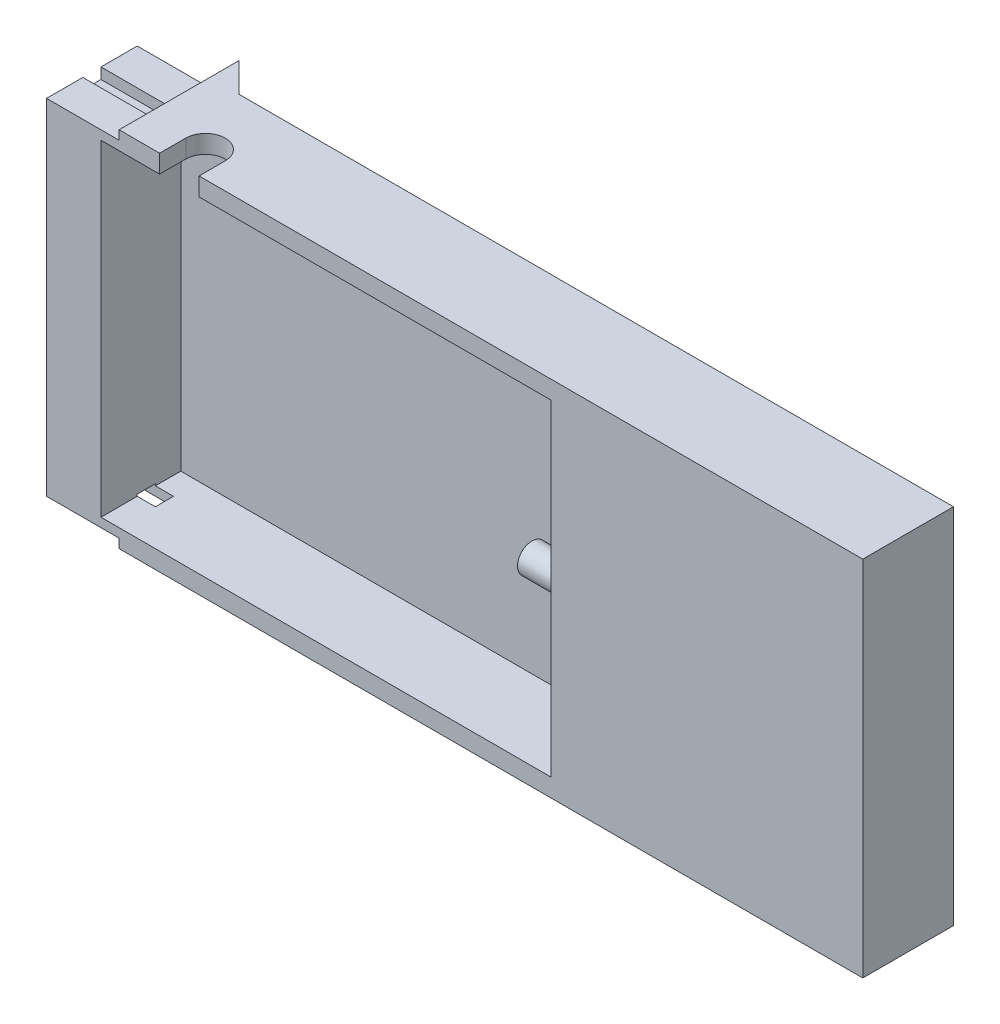
from build123d import *

# Parameters (mm, degrees)
SKETCH1_W           = 170
SKETCH1_H           = 100
BOSS_EXTRUDE1_DEPTH = 15
SKETCH3_W           = 70
SKETCH3_H           = 90
CUT_EXTRUDE2_DEPTH  = 12
SKETCH8_W           = 15
SKETCH8_H           = 15
CUT_EXTRUDE9_DEPTH  = 2.5
SKETCH9_W           = 15
SKETCH9_H           = 15
CUT_EXTRUDE10_DEPTH = 2.5
SKETCH10_W          = 12
SKETCH10_H          = 90
CUT_EXTRUDE11_DEPTH = 58
SKETCH11_W          = 128
SKETCH11_H          = 90
BOSS_EXTRUDE2_DEPTH = 10
SKETCH12_W          = 22
SKETCH12_H          = 90
BOSS_EXTRUDE4_DEPTH = 4
BOSS_EXTRUDE6_DEPTH = 100
SKETCH15_W          = 5
SKETCH15_H          = 3
CUT_EXTRUDE14_DEPTH = 15
SKETCH16_W          = 25
SKETCH16_H          = 100
BOSS_EXTRUDE7_DEPTH = 50
SKETCH17_W          = 70
SKETCH17_H          = 70
CUT_EXTRUDE15_DEPTH = 22
SKETCH18_W          = 74
SKETCH18_H          = 74
SKETCH18_W_2        = 70
SKETCH18_H_2        = 70
CUT_EXTRUDE16_DEPTH = 4
BOSS_EXTRUDE8_DEPTH = 5
SKETCH20_R          = 4
SKETCH20_R_2        = 3
BOSS_EXTRUDE9_DEPTH = 23
SKETCH20_2_R        = 3
CUT_EXTRUDE17_DEPTH = 23
CUT_EXTRUDE18_DEPTH = 23


with BuildPart() as part:
    # Sketch1 → Boss-Extrude1 (new body)
    with BuildSketch(Plane.XY):
        with Locations((-16.108033241, 2.077562327)):
            Rectangle(SKETCH1_W, SKETCH1_H)
    extrude(amount=BOSS_EXTRUDE1_DEPTH)

    # Sketch3 → Cut-Extrude2 (cut)
    with BuildSketch(Plane.XY.offset(15)):
        with Locations((-56.108033241, 2.077562327)):
            Rectangle(SKETCH3_W, SKETCH3_H)
    extrude(amount=-CUT_EXTRUDE2_DEPTH, mode=Mode.SUBTRACT)

    # Sketch8 → Cut-Extrude9 (cut)
    with BuildSketch(Plane(origin=(0, 52.077562327, 0), x_dir=(1, 0, 0), z_dir=(0, 1, 0))):
        with Locations((-93.608033241, -7.5)):
            Rectangle(SKETCH8_W, SKETCH8_H)
    extrude(amount=-CUT_EXTRUDE9_DEPTH, mode=Mode.SUBTRACT)

    # Sketch9 → Cut-Extrude10 (cut)
    with BuildSketch(Plane.XZ.offset(47.922437673)):
        with Locations((-93.608033241, 7.5)):
            Rectangle(SKETCH9_W, SKETCH9_H)
    extrude(amount=-CUT_EXTRUDE10_DEPTH, mode=Mode.SUBTRACT)

    # Sketch10 → Cut-Extrude11 (cut)
    with BuildSketch(Plane.ZY.offset(21.108033241)):
        with Locations((9, 2.077562327)):
            Rectangle(SKETCH10_W, SKETCH10_H)
    extrude(amount=-CUT_EXTRUDE11_DEPTH, mode=Mode.SUBTRACT)

    # Sketch11 → Boss-Extrude2 (add)
    with BuildSketch(Plane.XY.offset(15)):
        Polygon((-86.108033241, -45.422437673), (-86.108033241, -47.922437673), (68.891966759, -47.922437673), (68.891966759, 52.077562327), (-86.108033241, 52.077562327), (-86.108033241, 49.577562327), (-101.108033241, 49.577562327), (-101.108033241, -45.422437673), align=None)
        with Locations((-27.108033241, 2.077562327)):
            Rectangle(SKETCH11_W, SKETCH11_H, mode=Mode.SUBTRACT)
    extrude(amount=BOSS_EXTRUDE2_DEPTH)

    # Sketch12 → Boss-Extrude4 (add)
    with BuildSketch(Plane.ZY.offset(-36.891966759)):
        with Locations((14, 2.077562327)):
            Rectangle(SKETCH12_W, SKETCH12_H)
    extrude(amount=BOSS_EXTRUDE4_DEPTH)

    # Sketch14 → Boss-Extrude6 (add)
    with BuildSketch(Plane(origin=(0, 52.077562327, 0), x_dir=(1, 0, 0), z_dir=(0, 1, 0))):
        Polygon((-86.108033241, 0), (-78.108033241, 0), (-86.108033241, 8), align=None)
    extrude(amount=-BOSS_EXTRUDE6_DEPTH)

    # Sketch15 → Cut-Extrude14 (cut)
    with BuildSketch(Plane.ZY.offset(101.108033241)):
        with Locations((12.5, -43.922437673)):
            Rectangle(SKETCH15_W, SKETCH15_H)
        with Locations((12.5, 48.077562327)):
            Rectangle(SKETCH15_W, SKETCH15_H)
    extrude(amount=-CUT_EXTRUDE14_DEPTH, mode=Mode.SUBTRACT)

    # Sketch16 → Boss-Extrude7 (add)
    with BuildSketch(Plane(origin=(68.891966759, 0, 0), x_dir=(0, 0, -1), z_dir=(1, 0, 0))):
        with Locations((-12.5, 2.077562327)):
            Rectangle(SKETCH16_W, SKETCH16_H)
    extrude(amount=BOSS_EXTRUDE7_DEPTH)

    # Sketch17 → Cut-Extrude15 (cut)
    with BuildSketch(Plane(origin=(0, 0, 0), x_dir=(-1, 0, 0), z_dir=(0, 0, -1))):
        with Locations((-78.891966759, 2.077562327)):
            Rectangle(SKETCH17_W, SKETCH17_H)
    extrude(amount=-CUT_EXTRUDE15_DEPTH, mode=Mode.SUBTRACT)

    # Sketch18 → Cut-Extrude16 (cut)
    with BuildSketch(Plane(origin=(0, 0, 0), x_dir=(-1, 0, 0), z_dir=(0, 0, -1))):
        with Locations((-78.891966759, 2.077562327)):
            Rectangle(SKETCH18_W, SKETCH18_H)
        with Locations((-78.891966759, 2.077562327)):
            Rectangle(SKETCH18_W_2, SKETCH18_H_2, mode=Mode.SUBTRACT)
    extrude(amount=-CUT_EXTRUDE16_DEPTH, mode=Mode.SUBTRACT)

    # Sketch19 → Boss-Extrude8 (add)
    with BuildSketch(Plane.ZY.offset(101.108033241)):
        Polygon((10, 46.577562327), (10, 49.577562327), (0, 49.577562327), (0, -45.422437673), (10, -45.422437673), (10, -42.422437673), (15, -42.422437673), (15, -45.422437673), (25, -45.422437673), (25, 49.577562327), (15, 49.577562327), (15, 46.577562327), align=None)
    extrude(amount=BOSS_EXTRUDE8_DEPTH)

    # Sketch20 → Boss-Extrude9 (add)
    with BuildSketch(Plane(origin=(43.891966759, 0, 0), x_dir=(0, 0, -1), z_dir=(1, 0, 0))):
        with Locations((-18.181884359, 0)):
            Circle(SKETCH20_R)
        with Locations((-18.181884359, 0)):
            Circle(SKETCH20_R_2, mode=Mode.SUBTRACT)
    extrude(amount=-BOSS_EXTRUDE9_DEPTH)

    # Sketch20<2> → Cut-Extrude17 (cut)
    with BuildSketch(Plane(origin=(43.891966759, 0, 0), x_dir=(0, 0, -1), z_dir=(1, 0, 0))):
        with Locations((-18.181884359, 0)):
            Circle(SKETCH20_2_R)
    extrude(amount=-CUT_EXTRUDE17_DEPTH, mode=Mode.SUBTRACT)

    # Sketch21 → Cut-Extrude18 (cut)
    with BuildSketch(Plane(origin=(0, 52.077562327, 0), x_dir=(1, 0, 0), z_dir=(0, 1, 0))):
        with BuildLine():
            Line((-74.929235075, -25), (-74.929235075, -17.797726587))
            ThreePointArc((-74.929235075, -17.797726587), (-69.494183986, -12.362675498), (-64.059132898, -17.797726587))
            Line((-64.059132898, -17.797726587), (-64.059132898, -25))
            ThreePointArc((-64.059132898, -25), (-69.494183986, -30.435051089), (-74.929235075, -25))
        make_face()
    extrude(amount=-CUT_EXTRUDE18_DEPTH, mode=Mode.SUBTRACT)


solid = part.part
